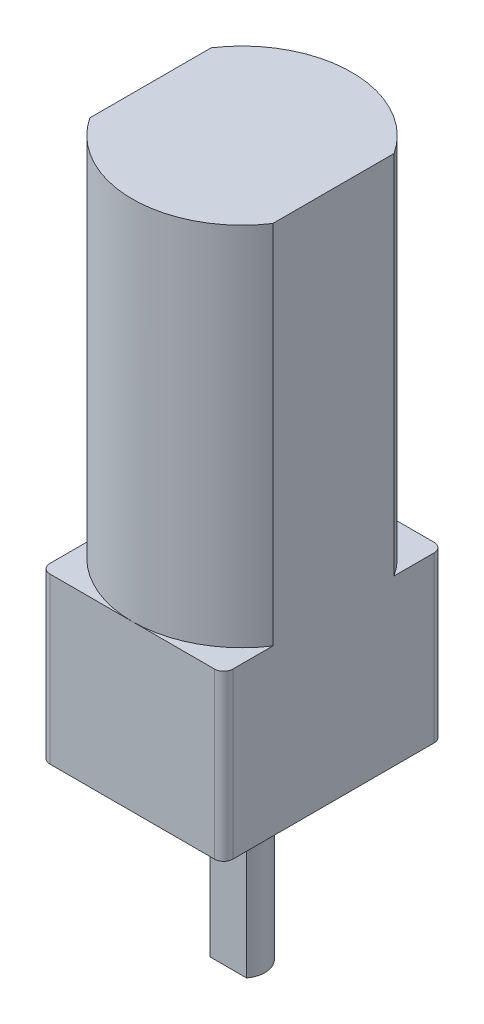
from build123d import *

# Parameters (mm, degrees)
SKETCH2_W           = 10
SKETCH2_H           = 12
BOSS_EXTRUDE1_DEPTH = 15
FILLET2_R           = 2.5
FILLET3_R           = 2.5
FILLET4_R           = 2.5
FILLET5_R           = 2.5
BOSS_EXTRUDE2_DEPTH = 9
FILLET6_R           = 0.5
SKETCH4_R           = 2
SKETCH4_R_2         = 1.25
BOSS_EXTRUDE4_DEPTH = 0.8
SKETCH5_R           = 1.25
BOSS_EXTRUDE5_DEPTH = 10
CUT_EXTRUDE1_START  = -9.2
CUT_EXTRUDE1_DEPTH  = 9.2
CUT_EXTRUDE2_DEPTH  = 15
BOSS_EXTRUDE7_DEPTH = 20


with BuildPart() as part:
    # Sketch2 → Boss-Extrude1 (new body)
    with BuildSketch(Plane(origin=(0, 0, 0), x_dir=(1, 0, 0), z_dir=(0, 1, 0))):
        with Locations((-5, -6)):
            Rectangle(SKETCH2_W, SKETCH2_H)
    extrude(amount=BOSS_EXTRUDE1_DEPTH)

    # Fillet2
    fillet2_edges = [part.edges().sort_by_distance(p)[0] for p in [
        (0, 7.5, 0),
    ]]
    fillet(fillet2_edges, radius=FILLET2_R)

    # Fillet3
    fillet3_edges = [part.edges().sort_by_distance(p)[0] for p in [
        (-10, 7.5, 0),
    ]]
    fillet(fillet3_edges, radius=FILLET3_R)

    # Fillet4
    fillet4_edges = [part.edges().sort_by_distance(p)[0] for p in [
        (-10, 7.5, 12),
    ]]
    fillet(fillet4_edges, radius=FILLET4_R)

    # Fillet5
    fillet5_edges = [part.edges().sort_by_distance(p)[0] for p in [
        (0, 7.5, 12),
    ]]
    fillet(fillet5_edges, radius=FILLET5_R)

    # Sketch3 → Boss-Extrude2 (add)
    with BuildSketch(Plane.XZ):
        with BuildLine():
            Line((0, 0), (0, 2.5))
            ThreePointArc((0, 2.5), (-0.732233047, 0.732233047), (-2.5, 0))
            Line((-2.5, 0), (0, 0))
        make_face()
        with BuildLine():
            ThreePointArc((-2.5, 0), (-0.732233047, 0.732233047), (0, 2.5))
            Line((0, 2.5), (-5, 6))
            Line((-5, 6), (-10, 2.5))
            ThreePointArc((-10, 2.5), (-9.267766953, 0.732233047), (-7.5, 0))
            Line((-7.5, 0), (-2.5, 0))
        make_face()
        with BuildLine():
            ThreePointArc((-7.5, 0), (-9.267766953, 0.732233047), (-10, 2.5))
            Line((-10, 2.5), (-10, 0))
            Line((-10, 0), (-7.5, 0))
        make_face()
        Polygon((-5, 6), (0, 2.5), (0, 9.5), align=None)
        Polygon((-10, 2.5), (-5, 6), (-10, 9.5), align=None)
        with BuildLine():
            Line((-10, 9.5), (-5, 6))
            Line((-5, 6), (0, 9.5))
            ThreePointArc((0, 9.5), (-0.732233047, 11.267766953), (-2.5, 12))
            Line((-2.5, 12), (-7.5, 12))
            ThreePointArc((-7.5, 12), (-9.267766953, 11.267766953), (-10, 9.5))
        make_face()
        with BuildLine():
            Line((-10, 12), (-10, 9.5))
            ThreePointArc((-10, 9.5), (-9.267766953, 11.267766953), (-7.5, 12))
            Line((-7.5, 12), (-10, 12))
        make_face()
        with BuildLine():
            ThreePointArc((-2.5, 12), (-0.732233047, 11.267766953), (0, 9.5))
            Line((0, 9.5), (0, 12))
            Line((0, 12), (-2.5, 12))
        make_face()
    extrude(amount=BOSS_EXTRUDE2_DEPTH)

    # Fillet6
    fillet6_edges = [part.edges().sort_by_distance(p)[0] for p in [
        (0, -4.5, 12),
        (-10, -4.5, 12),
        (-10, -4.5, 0),
        (0, -4.5, 0),
    ]]
    fillet(fillet6_edges, radius=FILLET6_R)

    # Sketch4 → Boss-Extrude4 (add)
    with BuildSketch(Plane.XZ.offset(9)):
        with Locations(Location((-5, 6, 0), (0, 0, 270))):
            Circle(SKETCH4_R)
        with Locations(Location((-5, 6, 0), (0, 0, 270))):
            Circle(SKETCH4_R_2, mode=Mode.SUBTRACT)
    extrude(amount=BOSS_EXTRUDE4_DEPTH)

    # Sketch5 → Boss-Extrude5 (add)
    with BuildSketch(Plane.XZ.offset(9)):
        with Locations(Location((-5, 6, 0), (0, 0, 270))):
            Circle(SKETCH5_R)
    extrude(amount=BOSS_EXTRUDE5_DEPTH)

    # Sketch6 → Cut-Extrude1 (cut)
    with BuildSketch(Plane.XZ.offset(19).offset(CUT_EXTRUDE1_START)):
        with BuildLine():
            Line((-6, 6.75), (-5, 6.75))
            Line((-5, 6.75), (-4, 6.75))
            ThreePointArc((-4, 6.75), (-5, 7.25), (-6, 6.75))
        make_face()
    extrude(amount=CUT_EXTRUDE1_DEPTH, mode=Mode.SUBTRACT)

    # Sketch8 → Cut-Extrude2 (cut)
    with BuildSketch(Plane(origin=(0, 15, 0), x_dir=(1, 0, 0), z_dir=(0, 1, 0))):
        with BuildLine():
            Line((-7.5, -12), (-2.5, -12))
            ThreePointArc((-2.5, -12), (-0.732233047, -11.267766953), (0, -9.5))
            Line((0, -9.5), (0, -2.5))
            ThreePointArc((0, -2.5), (-0.732233047, -0.732233047), (-2.5, 0))
            Line((-2.5, 0), (-7.5, 0))
            ThreePointArc((-7.5, 0), (-9.267766953, -0.732233047), (-10, -2.5))
            Line((-10, -2.5), (-10, -9.5))
            ThreePointArc((-10, -9.5), (-9.267766953, -11.267766953), (-7.5, -12))
        make_face()
    extrude(amount=-CUT_EXTRUDE2_DEPTH, mode=Mode.SUBTRACT)

    # Sketch9 → Boss-Extrude7 (add)
    with BuildSketch(Plane(origin=(0, 0, 0), x_dir=(1, 0, 0), z_dir=(0, 1, 0))):
        with BuildLine():
            Line((0, -9.31662479), (0, -2.68337521))
            ThreePointArc((0, -2.68337521), (-5, 0), (-10, -2.68337521))
            Line((-10, -2.68337521), (-10, -9.31662479))
            ThreePointArc((-10, -9.31662479), (-5, -12), (0, -9.31662479))
        make_face()
    extrude(amount=BOSS_EXTRUDE7_DEPTH)


solid = part.part
